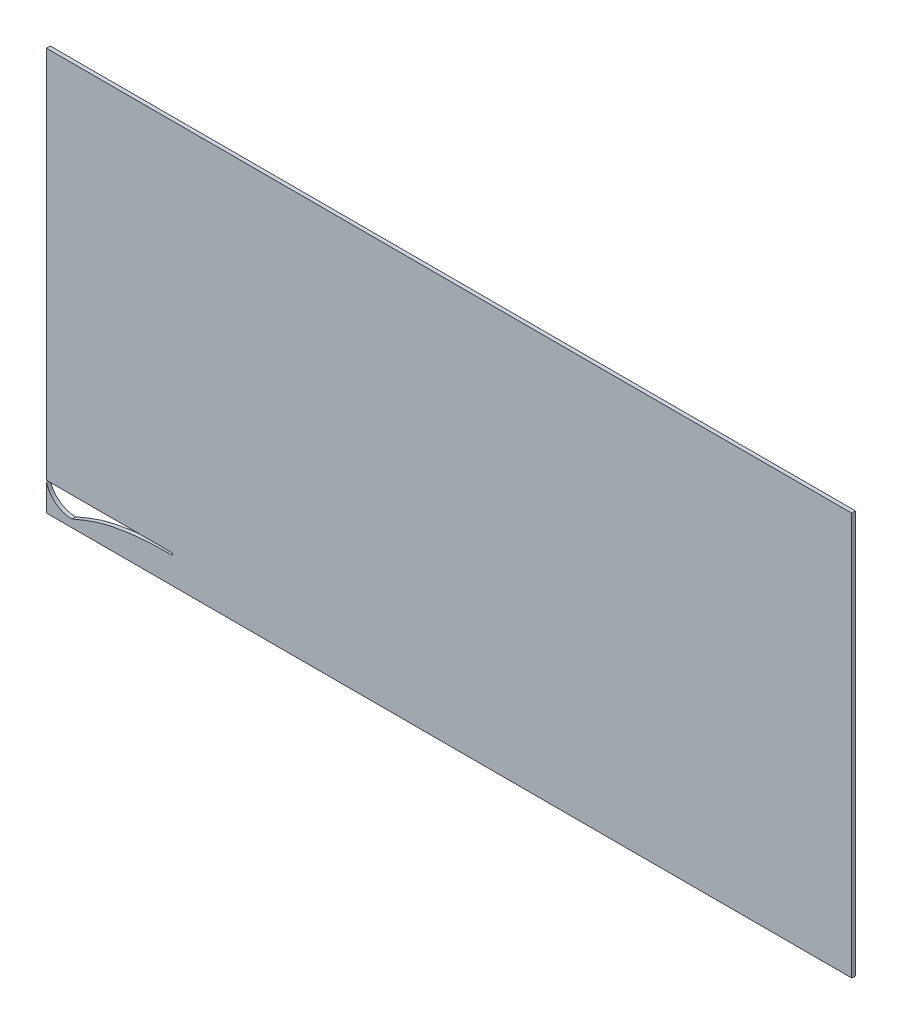
from build123d import *

# Parameters (mm, degrees)
BOSS_EXTRUDE1_DEPTH = 500


with BuildPart() as part:
    # Sketch1 → Boss-Extrude1 (new body)
    with BuildSketch(Plane.XY):
        with BuildLine():
            Line((-3353.856874341, 3499.178304373), (-3353.856874341, 0))
            Line((-3353.856874341, 0), (102806.143125659, 0))
            Line((102806.143125659, 0), (102806.143125659, 53080))
            Line((102806.143125659, 53080), (-3353.856874341, 53080))
            Line((-3353.856874341, 53080), (-3353.856874341, 3749.178304373))
            Line((-3353.856874341, 3749.178304373), (13271.843629608, 3749.178304373))
            Line((13271.843629608, 3749.178304373), (13271.843629608, 3499.178304373))
            add(Edge.make_bspline(
                [(0, 1000), (291.765900603, 1123.322488736), (781.522297226, 1330.330838858), (1362.897354233, 1573.653151088), (1725.58055856, 1720.77055381), (1954.57140661, 1810.926420972), (2153.700733637, 1887.07815454), (2340.113195958, 1956.278566329), (2520.568742906, 2021.269176864), (2698.631529223, 2083.441582039), (2876.496758345, 2143.60559098), (3055.666034414, 2202.270703111), (3237.250612129, 2259.773582693), (3422.126312829, 2316.342813928), (3611.0201096, 2372.13499832), (3804.562016384, 2427.256160941), (4003.317955266, 2481.775096262), (4207.811570405, 2535.731997309), (4418.539306117, 2589.144190276), (4635.981220127, 2642.010014835), (4860.60901013, 2694.311472469), (5092.892172544, 2746.016028353), (5333.302883792, 2797.077813252), (5582.319994726, 2847.438387022), (5840.432403528, 2897.027171884), (6108.141991809, 2945.761629128), (6385.966255513, 2993.547229939), (6674.440726513, 3040.277255451), (6974.121256361, 3085.832450297), (7285.586216703, 3130.080546165), (7609.438658958, 3172.875666363), (7946.308467423, 3214.05761783), (8296.854533956, 3253.451075226), (8661.766978119, 3290.864653641), (9041.76943365, 3326.089886388), (9437.621420016, 3358.900035556), (9850.120816466, 3389.049006357), (10280.106455001, 3416.269267446), (10728.460848663, 3440.273104087), (11196.113069896, 3460.739986102), (11684.04179999, 3477.358423093), (12193.278546938, 3489.650420084), (12724.911125486, 3497.660104241), (13086.92500481, 3498.66499884), (13271.843629608, 3499.178304373)],
                knots=[0, 0, 0, 0, 0.069755542, 0.117091212, 0.138787236, 0.155943701, 0.171285447, 0.185735274, 0.199731374, 0.213522724, 0.227268493, 0.241079694, 0.25503928, 0.269212874, 0.283654957, 0.298412647, 0.313528137, 0.329040333, 0.344985992, 0.361400555, 0.378318753, 0.395775091, 0.413804224, 0.432441268, 0.451722064, 0.47168341, 0.492363267, 0.513800952, 0.53603732, 0.559114937, 0.583078259, 0.6079738, 0.633850311, 0.660758958, 0.688753512, 0.717890543, 0.748229621, 0.779833533, 0.812768508, 0.847104461, 0.882915243, 0.920278917, 0.959278044, 1, 1, 1, 1], degree=3))
            ThreePointArc((0, 1000), (-2091.306298143, 1693.500762988), (-3353.856874341, 3499.178304373))
        make_face()
    extrude(amount=BOSS_EXTRUDE1_DEPTH)


solid = part.part
